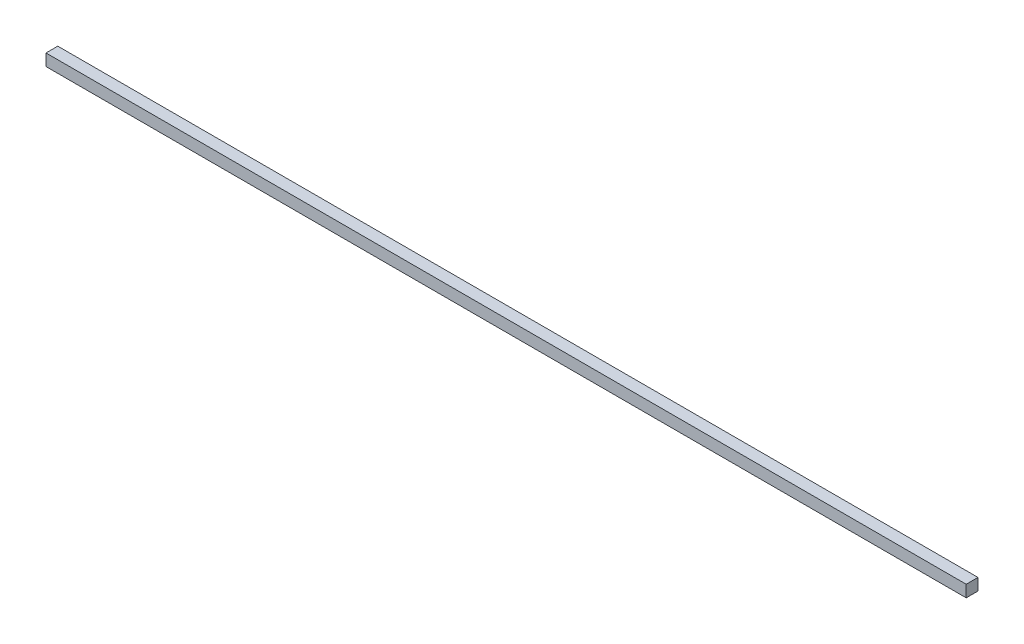
from build123d import *

# Parameters (mm, degrees)
SKETCH_1_W      = 390
SKETCH_1_H      = 5
EXTRUDE_1_DEPTH = 5


with BuildPart() as part:
    # ｽｹｯﾁ1 → ﾎﾞｽ - 押し出し1 (new body)
    with BuildSketch(Plane.XY):
        with Locations((112.848439705, 7.478571429)):
            Rectangle(SKETCH_1_W, SKETCH_1_H)
    extrude(amount=EXTRUDE_1_DEPTH)


solid = part.part
